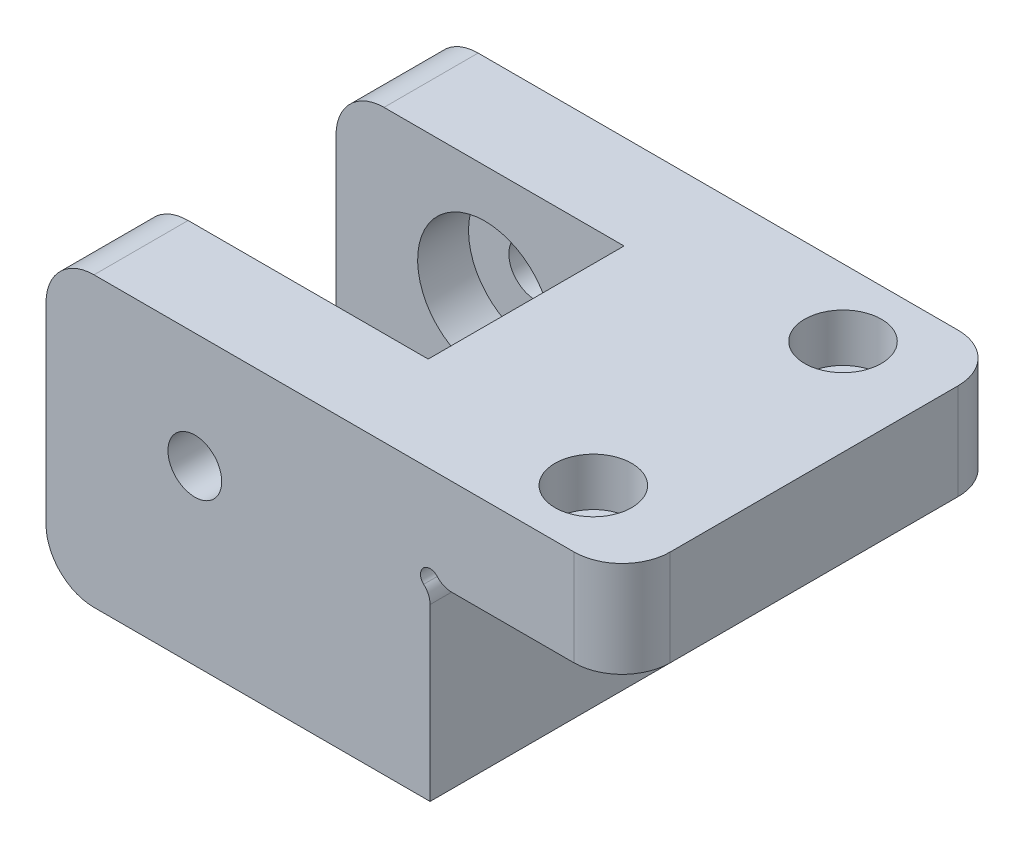
from build123d import *

# Parameters (mm, degrees)
DODANIE_WYCI_GNI_CIE1_DEPTH = 40
SZKIC4_W                    = 9.8
SZKIC4_H                    = 30
DODANIE_WYCI_GNI_CIE3_DEPTH = 30
SZKIC6_R                    = 7
WYTNIJ_WYCI_GNI_CIE1_DEPTH  = 65.031242374
SZKIC7_R                    = 4
WYTNIJ_WYCI_GNI_CIE2_DEPTH  = 5
SZKIC8_R                    = 2.1
WYTNIJ_WYCI_GNI_CIE3_DEPTH  = 5
SZKIC9_R                    = 4
WYTNIJ_WYCI_GNI_CIE4_DEPTH  = 5
SZKIC10_R                   = 2.1
WYTNIJ_WYCI_GNI_CIE5_DEPTH  = 5
ZAOKR_GLENIE1_R             = 5
ZAOKR_GLENIE2_R             = 5
SZKIC11_R                   = 7
DODANIE_WYCI_GNI_CIE5_DEPTH = 4.5
SZKIC12_R                   = 2.8
WYTNIJ_WYCI_GNI_CIE6_DEPTH  = 65.031242374


with BuildPart() as part:
    # Szkic1 → Dodanie-wyciągnięcie1 (new body)
    with BuildSketch(Plane.XY):
        with BuildLine():
            Line((0, 0), (0, 17.763932023))
            ThreePointArc((0, 17.763932023), (-0.174258142, 18.580428603), (-0.666666667, 19.254644008))
            ThreePointArc((-0.666666667, 19.254644008), (-0.707106781, 20.707106781), (0.745355992, 20.666666667))
            ThreePointArc((0.745355992, 20.666666667), (1.419571397, 20.174258142), (2.236067977, 20))
            Line((2.236067977, 20), (20, 20))
            Line((20, 20), (20, 30))
            Line((20, 30), (-10, 30))
            Line((-10, 30), (-10, 0))
            Line((-10, 0), (0, 0))
        make_face()
    extrude(amount=DODANIE_WYCI_GNI_CIE1_DEPTH)

    # Szkic4 → Dodanie-wyciągnięcie3 (add)
    with BuildSketch(Plane.ZY.offset(10)):
        with Locations((35.1, 15)):
            Rectangle(SZKIC4_W, SZKIC4_H)
        with Locations((4.9, 15)):
            Rectangle(SZKIC4_W, SZKIC4_H)
    extrude(amount=DODANIE_WYCI_GNI_CIE3_DEPTH)

    # Szkic6 → Wytnij-wyciągnięcie1 (cut, through all)
    with BuildSketch(Plane.XY.offset(40)):
        with Locations((-24.5, 18)):
            Circle(SZKIC6_R)
    extrude(amount=-WYTNIJ_WYCI_GNI_CIE1_DEPTH, mode=Mode.SUBTRACT)

    # Szkic7 → Wytnij-wyciągnięcie2 (cut)
    with BuildSketch(Plane.ZY.offset(10)):
        with Locations(Location((20, 10, 0), (0, 0, 270))):
            Circle(SZKIC7_R)
    extrude(amount=-WYTNIJ_WYCI_GNI_CIE2_DEPTH, mode=Mode.SUBTRACT)

    # Szkic8 → Wytnij-wyciągnięcie3 (cut)
    with BuildSketch(Plane.ZY.offset(5)):
        with Locations(Location((20, 10, 0), (0, 0, 270))):
            Circle(SZKIC8_R)
    extrude(amount=-WYTNIJ_WYCI_GNI_CIE3_DEPTH, mode=Mode.SUBTRACT)

    # Szkic9 → Wytnij-wyciągnięcie4 (cut)
    with BuildSketch(Plane(origin=(0, 30, 0), x_dir=(1, 0, 0), z_dir=(0, 1, 0))):
        with Locations(Location((10, -33, 0), (0, 0, 180))):
            Circle(SZKIC9_R)
        with Locations(Location((10, -7, 0), (0, 0, 180))):
            Circle(SZKIC9_R)
    extrude(amount=-WYTNIJ_WYCI_GNI_CIE4_DEPTH, mode=Mode.SUBTRACT)

    # Szkic10 → Wytnij-wyciągnięcie5 (cut)
    with BuildSketch(Plane(origin=(0, 25, 0), x_dir=(1, 0, 0), z_dir=(0, 1, 0))):
        with Locations(Location((10, -33, 0), (0, 0, 180))):
            Circle(SZKIC10_R)
        with Locations(Location((10, -7, 0), (0, 0, 180))):
            Circle(SZKIC10_R)
    extrude(amount=-WYTNIJ_WYCI_GNI_CIE5_DEPTH, mode=Mode.SUBTRACT)

    # Zaokrąglenie1
    zaokr_glenie1_edges = [part.edges().sort_by_distance(p)[0] for p in [
        (20, 25, 0),
        (20, 25, 40),
    ]]
    fillet(zaokr_glenie1_edges, radius=ZAOKR_GLENIE1_R)

    # Zaokrąglenie2
    zaokr_glenie2_edges = [part.edges().sort_by_distance(p)[0] for p in [
        (-40, 30, 35.1),
        (-40, 0, 35.1),
        (-40, 0, 4.9),
        (-40, 30, 4.9),
    ]]
    fillet(zaokr_glenie2_edges, radius=ZAOKR_GLENIE2_R)

    # Szkic11 → Dodanie-wyciągnięcie5 (add)
    with BuildSketch(Plane.XY.offset(40)):
        with Locations((-24.5, 18)):
            Circle(SZKIC11_R)
    dodanie_wyci_gni_cie5 = extrude(amount=-DODANIE_WYCI_GNI_CIE5_DEPTH)

    # Lustro1: Dodanie-wyciągnięcie5 across plane
    add(dodanie_wyci_gni_cie5.mirror(Plane.XY.offset(20)))

    # Szkic12 → Wytnij-wyciągnięcie6 (cut, through all)
    with BuildSketch(Plane.XY.offset(40)):
        with Locations((-24.5, 18)):
            Circle(SZKIC12_R)
    extrude(amount=-WYTNIJ_WYCI_GNI_CIE6_DEPTH, mode=Mode.SUBTRACT)


solid = part.part
